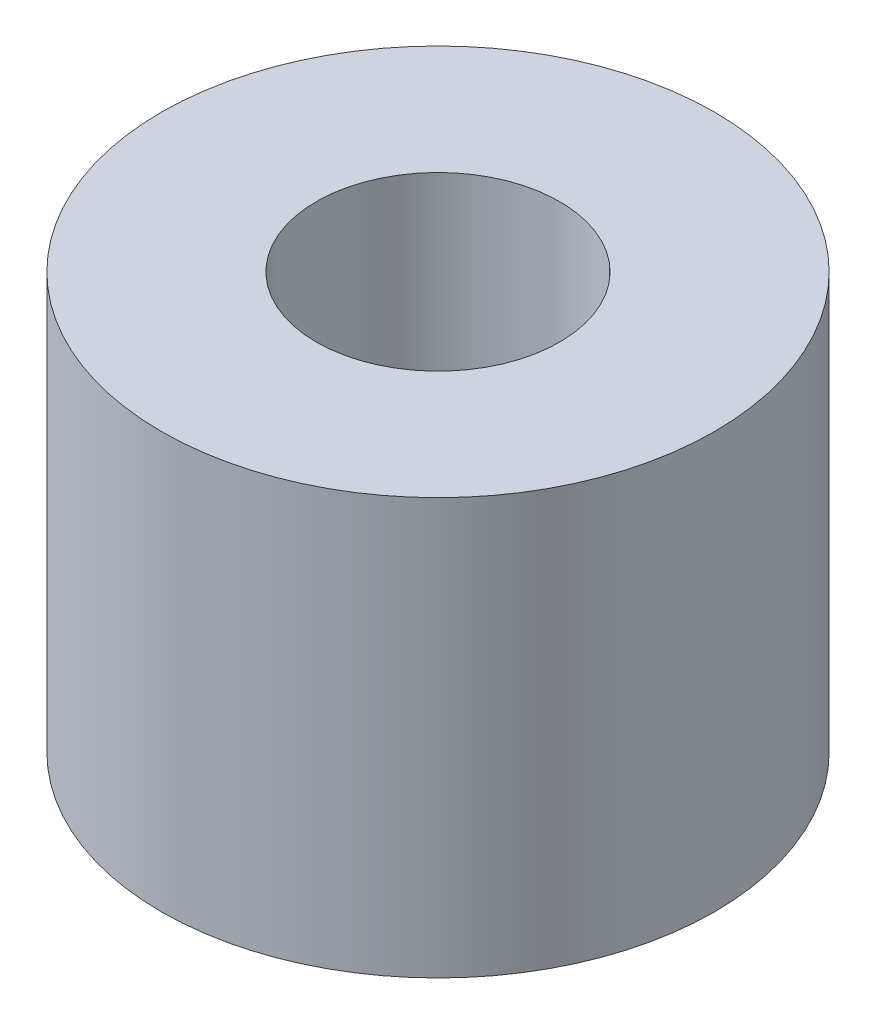
from build123d import *

# Parameters (mm, degrees)
SKETCH1_R           = 25
SKETCH1_R_2         = 11
BOSS_EXTRUDE1_DEPTH = 37.6


with BuildPart() as part:
    # Sketch1 → Boss-Extrude1 (new body)
    with BuildSketch(Plane(origin=(0, 0, 0), x_dir=(1, 0, 0), z_dir=(0, 1, 0))):
        with Locations(Location((0, 0, 0), (0, 0, 270))):
            Circle(SKETCH1_R)
        with Locations(Location((0, 0, 0), (0, 0, 270))):
            Circle(SKETCH1_R_2, mode=Mode.SUBTRACT)
    extrude(amount=BOSS_EXTRUDE1_DEPTH)


solid = part.part
